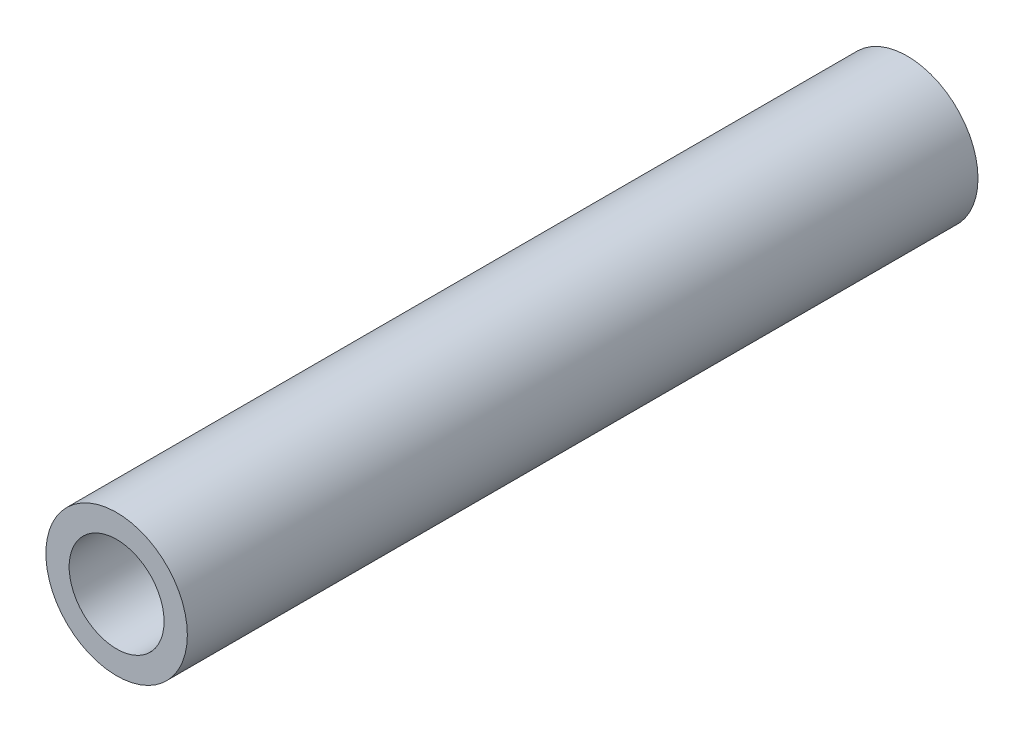
from build123d import *

# Parameters (mm, degrees)
SKETCH1_R           = 1.99
SKETCH1_R_2         = 1.335
BOSS_EXTRUDE1_DEPTH = 22.24


with BuildPart() as part:
    # Sketch1 → Boss-Extrude1 (new body)
    with BuildSketch(Plane.XY):
        Circle(SKETCH1_R)
        Circle(SKETCH1_R_2, mode=Mode.SUBTRACT)
    extrude(amount=BOSS_EXTRUDE1_DEPTH)


solid = part.part
